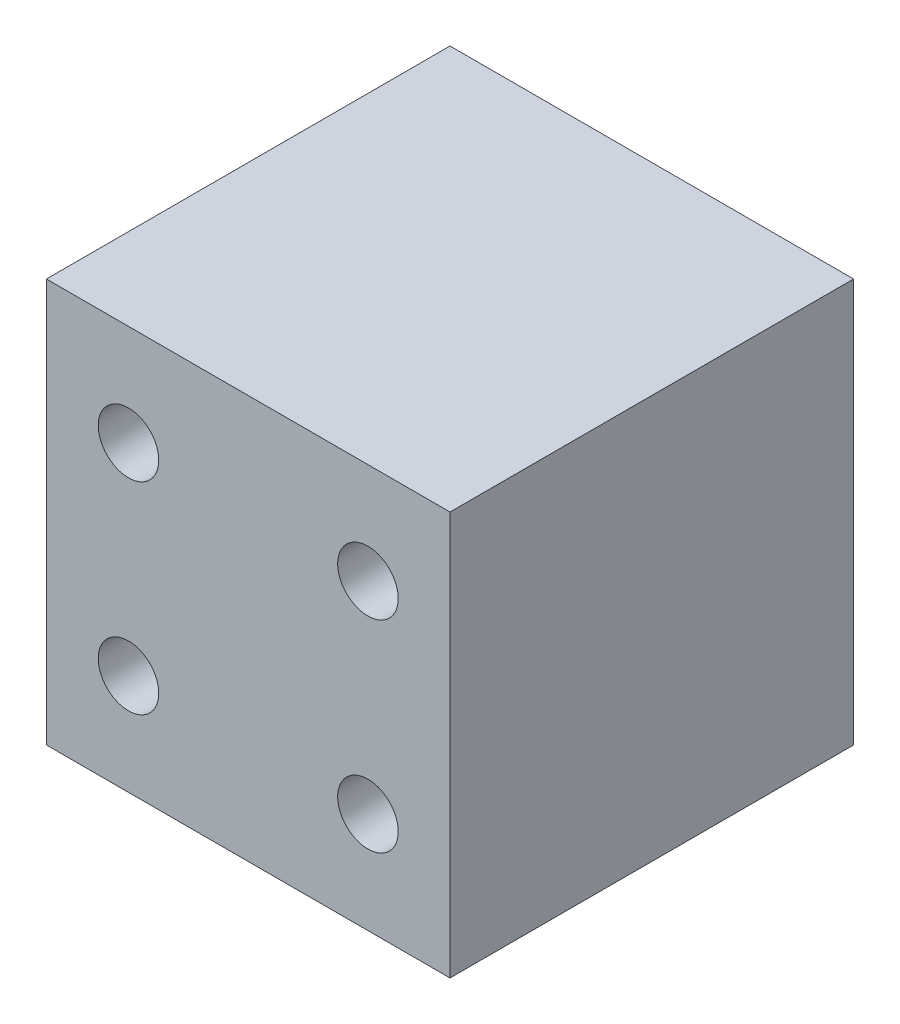
from build123d import *

# Parameters (mm, degrees)
SKETCH_1_W          = 30
SKETCH_1_H          = 30
EXTRUDE_1_DEPTH     = 30
SKETCH_4_R          = 2.25
CUT_EXTRUDE_2_DEPTH = 37.742346142


with BuildPart() as part:
    # 草图1 → 凸台-拉伸1 (new body)
    with BuildSketch(Plane.XY):
        Rectangle(SKETCH_1_W, SKETCH_1_H)
    extrude(amount=EXTRUDE_1_DEPTH)

    # 草图4 → 切除-拉伸2 (cut, through all)
    with BuildSketch(Plane.XY.offset(30)):
        with Locations((8.9, 7.5)):
            Circle(SKETCH_4_R)
        with Locations((8.9, -7.5)):
            Circle(SKETCH_4_R)
        with Locations((-8.9, 7.5)):
            Circle(SKETCH_4_R)
        with Locations((-8.9, -7.5)):
            Circle(SKETCH_4_R)
    extrude(amount=-CUT_EXTRUDE_2_DEPTH, mode=Mode.SUBTRACT)


solid = part.part
